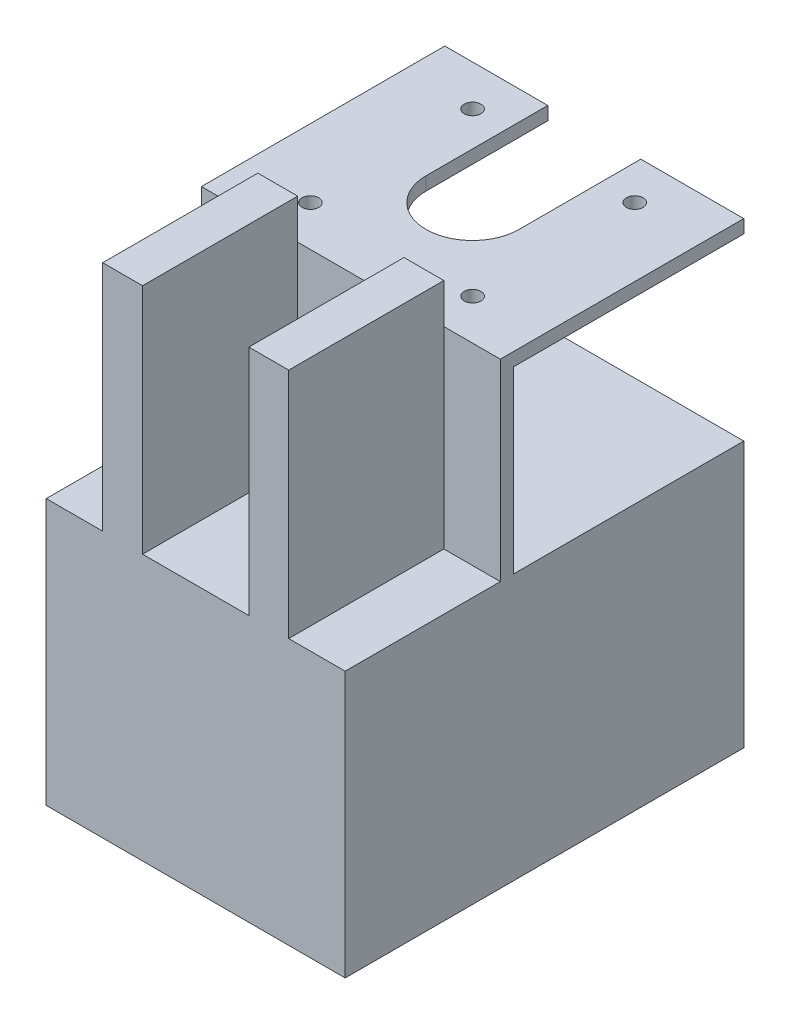
from build123d import *

# Parameters (mm, degrees)
SKETCH3_W                         = 57.15
SKETCH3_H                         = 76.2
BOSS_EXTRUDE2_DEPTH               = 50.8
SKETCH4_W                         = 49.53
SKETCH4_H                         = 68.58
CUT_EXTRUDE2_DEPTH                = 44.45
CUT_EXTRUDE3_REACH                = 109.95
SKETCH5_W                         = 9.398
SKETCH5_H                         = 11.43
MOTOR_MOUNTING_SHAPE_DEPTH        = 57.15
MOTOR_MOUNTING_HOLES_REACH        = 131.428
SKETCH8_R                         = 1.6
SKETCH7_W                         = 7.62
SKETCH7_H                         = 29.66
TRAY_SUPPORT_MOUNTING_SHAPE_DEPTH = 44.45


with BuildPart() as part:
    # Sketch3 → Boss-Extrude2 (new body)
    with BuildSketch(Plane(origin=(0, 0, 0), x_dir=(-1, 0, 0), z_dir=(0, 1, 0))):
        with Locations((28.575, 38.1)):
            Rectangle(SKETCH3_W, SKETCH3_H)
    extrude(amount=-BOSS_EXTRUDE2_DEPTH)

    # Sketch4 → Cut-Extrude2 (cut)
    with BuildSketch(Plane.XZ.offset(50.8)):
        with Locations((-28.575, 38.1)):
            Rectangle(SKETCH4_W, SKETCH4_H)
    extrude(amount=-CUT_EXTRUDE2_DEPTH, mode=Mode.SUBTRACT)

    # Sketch5 → Cut-Extrude3 (cut, up to next)
    with BuildSketch(Plane(origin=(-57.15, 0, 0), x_dir=(0, 0, -1), z_dir=(1, 0, 0)), mode=Mode.PRIVATE) as cut_extrude3_sk1:
        with Locations((-9.779, -41.275)):
            Rectangle(SKETCH5_W, SKETCH5_H)
    cut_extrude3_tool1 = extrude(cut_extrude3_sk1.sketch, amount=CUT_EXTRUDE3_REACH, mode=Mode.PRIVATE) & part.part
    add(cut_extrude3_tool1.solids().sort_by_distance((-57.15, -41.275, 9.779))[0], mode=Mode.SUBTRACT)

    # Sketch6 → Motor Mounting Shape (add)
    with BuildSketch(Plane.ZY.offset(57.15)):
        Polygon((46.54, 0), (46.54, 36.83), (0, 36.83), (0, 34.29), (44, 34.29), (44, 0), align=None)
    extrude(amount=-MOTOR_MOUNTING_SHAPE_DEPTH)

    # Sketch8 → Motor-Mounting-Holes (cut, up to next)
    with BuildSketch(Plane(origin=(0, 36.83, 0), x_dir=(1, 0, 0), z_dir=(0, 1, 0)), mode=Mode.PRIVATE) as motor_mounting_holes_sk1:
        with Locations(Location((-44.075, -7.77, 0), (0, 0, 270))):
            Circle(SKETCH8_R)
    motor_mounting_holes_tool1 = extrude(motor_mounting_holes_sk1.sketch, amount=-MOTOR_MOUNTING_HOLES_REACH, mode=Mode.PRIVATE) & part.part
    # Sketch8 → Motor-Mounting-Holes (cut, up to next)
    with BuildSketch(Plane(origin=(0, 36.83, 0), x_dir=(1, 0, 0), z_dir=(0, 1, 0)), mode=Mode.PRIVATE) as motor_mounting_holes_sk2:
        with Locations(Location((-13.075, -7.77, 0), (0, 0, 270))):
            Circle(SKETCH8_R)
    motor_mounting_holes_tool2 = extrude(motor_mounting_holes_sk2.sketch, amount=-MOTOR_MOUNTING_HOLES_REACH, mode=Mode.PRIVATE) & part.part
    # Sketch8 → Motor-Mounting-Holes (cut, up to next)
    with BuildSketch(Plane(origin=(0, 36.83, 0), x_dir=(1, 0, 0), z_dir=(0, 1, 0)), mode=Mode.PRIVATE) as motor_mounting_holes_sk3:
        with Locations(Location((-13.075, -38.77, 0), (0, 0, 270))):
            Circle(SKETCH8_R)
    motor_mounting_holes_tool3 = extrude(motor_mounting_holes_sk3.sketch, amount=-MOTOR_MOUNTING_HOLES_REACH, mode=Mode.PRIVATE) & part.part
    # Sketch8 → Motor-Mounting-Holes (cut, up to next)
    with BuildSketch(Plane(origin=(0, 36.83, 0), x_dir=(1, 0, 0), z_dir=(0, 1, 0)), mode=Mode.PRIVATE) as motor_mounting_holes_sk4:
        with Locations(Location((-44.075, -38.77, 0), (0, 0, 270))):
            Circle(SKETCH8_R)
    motor_mounting_holes_tool4 = extrude(motor_mounting_holes_sk4.sketch, amount=-MOTOR_MOUNTING_HOLES_REACH, mode=Mode.PRIVATE) & part.part
    # Sketch8 → Motor-Mounting-Holes (cut, up to next)
    with BuildSketch(Plane(origin=(0, 36.83, 0), x_dir=(1, 0, 0), z_dir=(0, 1, 0)), mode=Mode.PRIVATE) as motor_mounting_holes_sk5:
        with BuildLine():
            Line((-37.465, 0), (-19.685, 0))
            Line((-19.685, 0), (-19.685, -23.27))
            ThreePointArc((-19.685, -23.27), (-28.575, -32.16), (-37.465, -23.27))
            Line((-37.465, -23.27), (-37.465, 0))
        make_face()
    motor_mounting_holes_tool5 = extrude(motor_mounting_holes_sk5.sketch, amount=-MOTOR_MOUNTING_HOLES_REACH, mode=Mode.PRIVATE) & part.part
    add(motor_mounting_holes_tool1.solids().sort_by_distance((-44.075, 36.83, 7.77))[0], mode=Mode.SUBTRACT)
    add(motor_mounting_holes_tool2.solids().sort_by_distance((-13.075, 36.83, 7.77))[0], mode=Mode.SUBTRACT)
    add(motor_mounting_holes_tool3.solids().sort_by_distance((-13.075, 36.83, 38.77))[0], mode=Mode.SUBTRACT)
    add(motor_mounting_holes_tool4.solids().sort_by_distance((-44.075, 36.83, 38.77))[0], mode=Mode.SUBTRACT)
    add(motor_mounting_holes_tool5.solids().sort_by_distance((-28.575, 36.83, 15.191166))[0], mode=Mode.SUBTRACT)

    # Sketch7 → Tray Support Mounting Shape (add)
    with BuildSketch(Plane(origin=(0, 0, 0), x_dir=(1, 0, 0), z_dir=(0, 1, 0))):
        with Locations((-42.545, -61.37)):
            Rectangle(SKETCH7_W, SKETCH7_H)
        with Locations((-14.605, -61.37)):
            Rectangle(SKETCH7_W, SKETCH7_H)
    extrude(amount=TRAY_SUPPORT_MOUNTING_SHAPE_DEPTH)


solid = part.part
